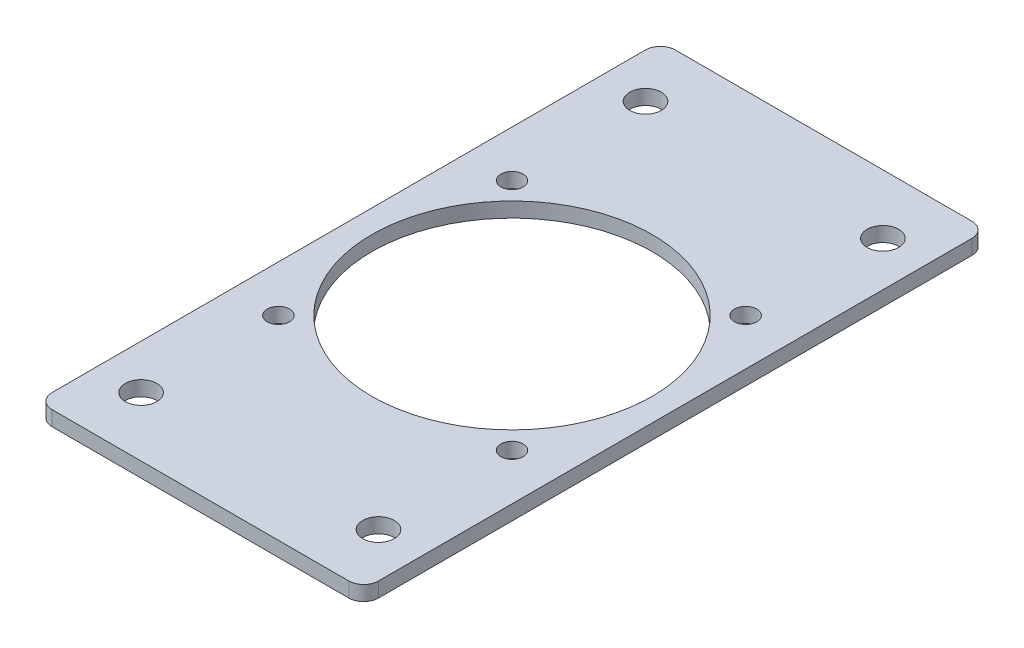
from build123d import *

# Parameters (mm, degrees)
SKETCH1_W                      = 69.85
SKETCH1_H                      = 133.35
BOSS_EXTRUDE1_DEPTH            = 3.175
SKETCH2_R                      = 30
CUT_EXTRUDE1_DEPTH             = 3.175
F_3_16_0_1875_DIAMETER_HOLE1_D = 4.7625
F_1_4_CLEARANCE_HOLE1_D        = 6.7564
F_1_4_CLEARANCE_HOLE1_DEPTH    = 3.175
FILLET1_R                      = 3.175


with BuildPart() as part:
    # Sketch1 → Boss-Extrude1 (new body)
    with BuildSketch(Plane(origin=(0, 0, 0), x_dir=(1, 0, 0), z_dir=(0, 1, 0))):
        Rectangle(SKETCH1_W, SKETCH1_H)
    extrude(amount=BOSS_EXTRUDE1_DEPTH)

    # Sketch2 → Cut-Extrude1 (cut)
    with BuildSketch(Plane(origin=(0, 3.175, 0), x_dir=(1, 0, 0), z_dir=(0, 1, 0))):
        with Locations(Location((0, 0, 0), (0, 0, 270))):
            Circle(SKETCH2_R)
    extrude(amount=-CUT_EXTRUDE1_DEPTH, mode=Mode.SUBTRACT)

    # 3/16 (0.1875) Diameter Hole1 (through all)
    with Locations(Plane(origin=(0, 3.175, 0), x_dir=(1, 0, 0), z_dir=(0, 1, 0))):
        with Locations((25, -25), (25, 25), (-25, -25), (-25, 25)):
            Hole(F_3_16_0_1875_DIAMETER_HOLE1_D / 2)

    # 1/4 Clearance Hole1
    with Locations(Plane(origin=(0, 3.175, 0), x_dir=(1, 0, 0), z_dir=(0, 1, 0))):
        with Locations((0, 0), (25.4, 53.975), (-25.4, -53.975), (-25.4, 53.975), (25.4, -53.975)):
            Hole(F_1_4_CLEARANCE_HOLE1_D / 2, depth=F_1_4_CLEARANCE_HOLE1_DEPTH)

    # Fillet1
    fillet1_edges = [part.edges().sort_by_distance(p)[0] for p in [
        (34.925, 1.5875, 66.675),
        (-34.925, 1.5875, 66.675),
        (-34.925, 1.5875, -66.675),
        (34.925, 1.5875, -66.675),
    ]]
    fillet(fillet1_edges, radius=FILLET1_R)


solid = part.part
